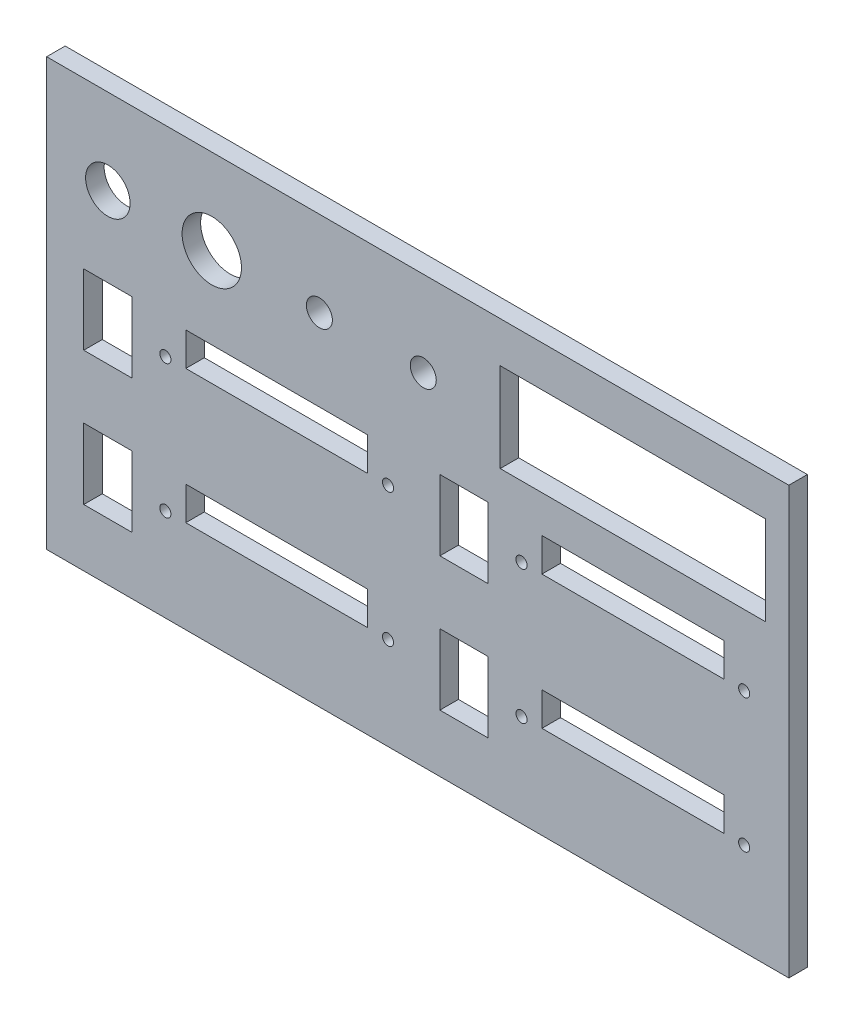
from build123d import *

# Parameters (mm, degrees)
SKETCH1_W           = 200
SKETCH1_H           = 115
SKETCH1_R           = 1.5
SKETCH1_R_2         = 6
SKETCH1_R_3         = 8
SKETCH1_R_4         = 3.5
SKETCH1_W_2         = 49
SKETCH1_H_2         = 9
SKETCH1_W_3         = 13
SKETCH1_H_3         = 19
SKETCH1_W_4         = 71.5
SKETCH1_H_4         = 24
BOSS_EXTRUDE1_DEPTH = 5


with BuildPart() as part:
    # Sketch1 → Boss-Extrude1 (new body)
    with BuildSketch(Plane.XY):
        Rectangle(SKETCH1_W, SKETCH1_H)
        with Locations((-68, -32.5)):
            Circle(SKETCH1_R, mode=Mode.SUBTRACT)
        with Locations((-8, -32.5)):
            Circle(SKETCH1_R, mode=Mode.SUBTRACT)
        with Locations((87.971622358, -32.5)):
            Circle(SKETCH1_R, mode=Mode.SUBTRACT)
        with Locations((27.971622358, -32.5)):
            Circle(SKETCH1_R, mode=Mode.SUBTRACT)
        with Locations((87.971622358, 3.5)):
            Circle(SKETCH1_R, mode=Mode.SUBTRACT)
        with Locations((27.971622358, 3.5)):
            Circle(SKETCH1_R, mode=Mode.SUBTRACT)
        with Locations((-8, 3.5)):
            Circle(SKETCH1_R, mode=Mode.SUBTRACT)
        with Locations((-68, 3.5)):
            Circle(SKETCH1_R, mode=Mode.SUBTRACT)
        with Locations((-83.5, 34.5)):
            Circle(SKETCH1_R_2, mode=Mode.SUBTRACT)
        with Locations((-55.5, 34.5)):
            Circle(SKETCH1_R_3, mode=Mode.SUBTRACT)
        with Locations((1.5, 34.5)):
            Circle(SKETCH1_R_4, mode=Mode.SUBTRACT)
        with Locations((-26.5, 34.5)):
            Circle(SKETCH1_R_4, mode=Mode.SUBTRACT)
        with Locations((-38, -28)):
            Rectangle(SKETCH1_W_2, SKETCH1_H_2, mode=Mode.SUBTRACT)
        with Locations((-83.5, -32.5)):
            Rectangle(SKETCH1_W_3, SKETCH1_H_3, mode=Mode.SUBTRACT)
        with Locations((57.971622358, -28)):
            Rectangle(SKETCH1_W_2, SKETCH1_H_2, mode=Mode.SUBTRACT)
        with Locations((12.471622358, -32.5)):
            Rectangle(SKETCH1_W_3, SKETCH1_H_3, mode=Mode.SUBTRACT)
        with Locations((57.971622358, 8)):
            Rectangle(SKETCH1_W_2, SKETCH1_H_2, mode=Mode.SUBTRACT)
        with Locations((12.471622358, 3.5)):
            Rectangle(SKETCH1_W_3, SKETCH1_H_3, mode=Mode.SUBTRACT)
        with Locations((-38, 8)):
            Rectangle(SKETCH1_W_2, SKETCH1_H_2, mode=Mode.SUBTRACT)
        with Locations((-83.5, 3.5)):
            Rectangle(SKETCH1_W_3, SKETCH1_H_3, mode=Mode.SUBTRACT)
        with Locations((57.971622358, 34.5)):
            Rectangle(SKETCH1_W_4, SKETCH1_H_4, mode=Mode.SUBTRACT)
    extrude(amount=BOSS_EXTRUDE1_DEPTH)


solid = part.part
